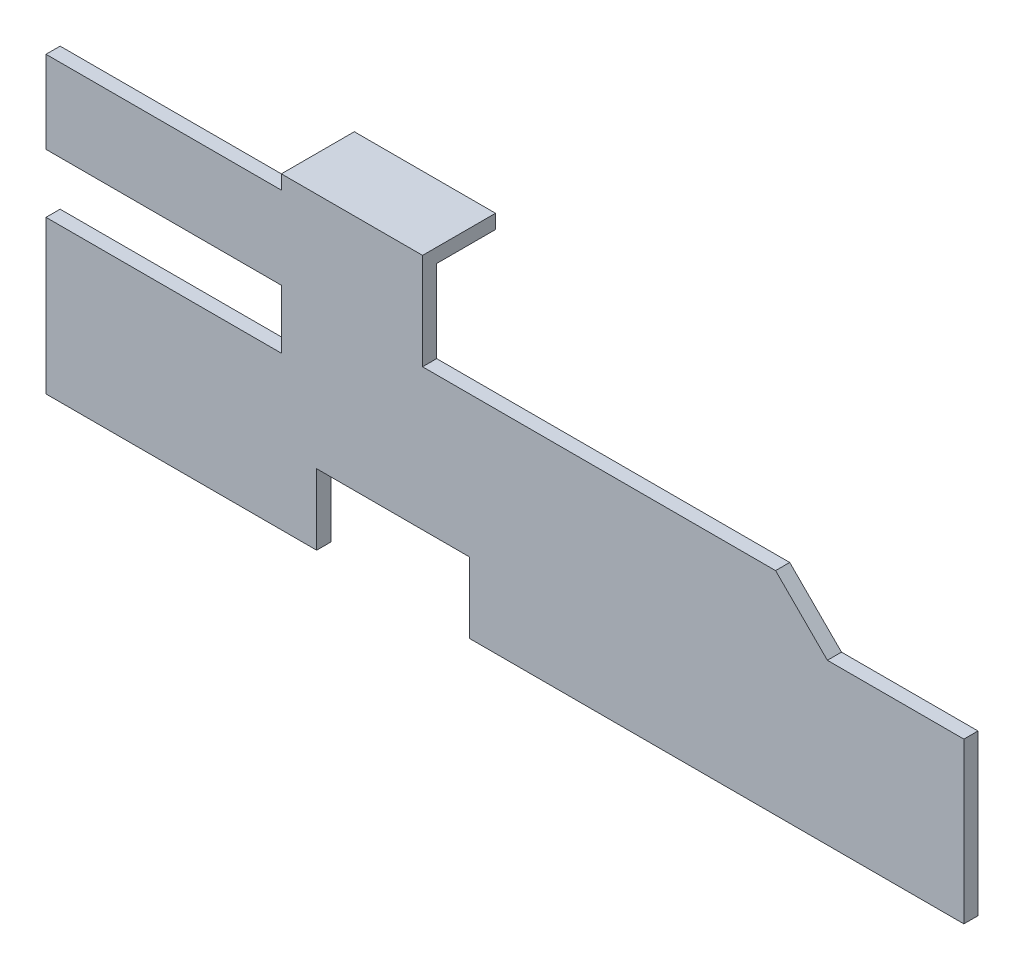
from build123d import *

# Parameters (mm, degrees)
EXTRUDE_1_DEPTH     = 0.6
SKETCH_2_W          = 6
SKETCH_2_H          = 0.6
EXTRUDE_2_DEPTH     = 2.5
SKETCH_3_W          = 6
SKETCH_3_H          = 1.9
CUT_EXTRUDE_1_DEPTH = 42.859885332


with BuildPart() as part:
    # 草图1 → 凸台-拉伸1 (new body)
    with BuildSketch(Plane.XY):
        Polygon((0, 0), (11.5, 0), (11.5, 3), (18, 3), (18, 0), (39, 0), (39, 6.8), (33.2, 6.8), (31, 9), (16, 9), (16, 15), (10, 15), (10, 12.5), (0, 12.5), (0, 9), (10, 9), (10, 6.5), (0, 6.5), align=None)
    extrude(amount=EXTRUDE_1_DEPTH)

    # 草图2 → 凸台-拉伸2 (add)
    with BuildSketch(Plane(origin=(0, 0, 0), x_dir=(-1, 0, 0), z_dir=(0, 0, -1))):
        with Locations((-13, 12.8)):
            Rectangle(SKETCH_2_W, SKETCH_2_H)
    extrude(amount=EXTRUDE_2_DEPTH)

    # 草图3 → 切除-拉伸1 (cut, through all)
    with BuildSketch(Plane(origin=(0, 0, 0), x_dir=(-1, 0, 0), z_dir=(0, 0, -1))):
        with Locations((-13, 14.05)):
            Rectangle(SKETCH_3_W, SKETCH_3_H)
    extrude(amount=-CUT_EXTRUDE_1_DEPTH, mode=Mode.SUBTRACT)


solid = part.part
